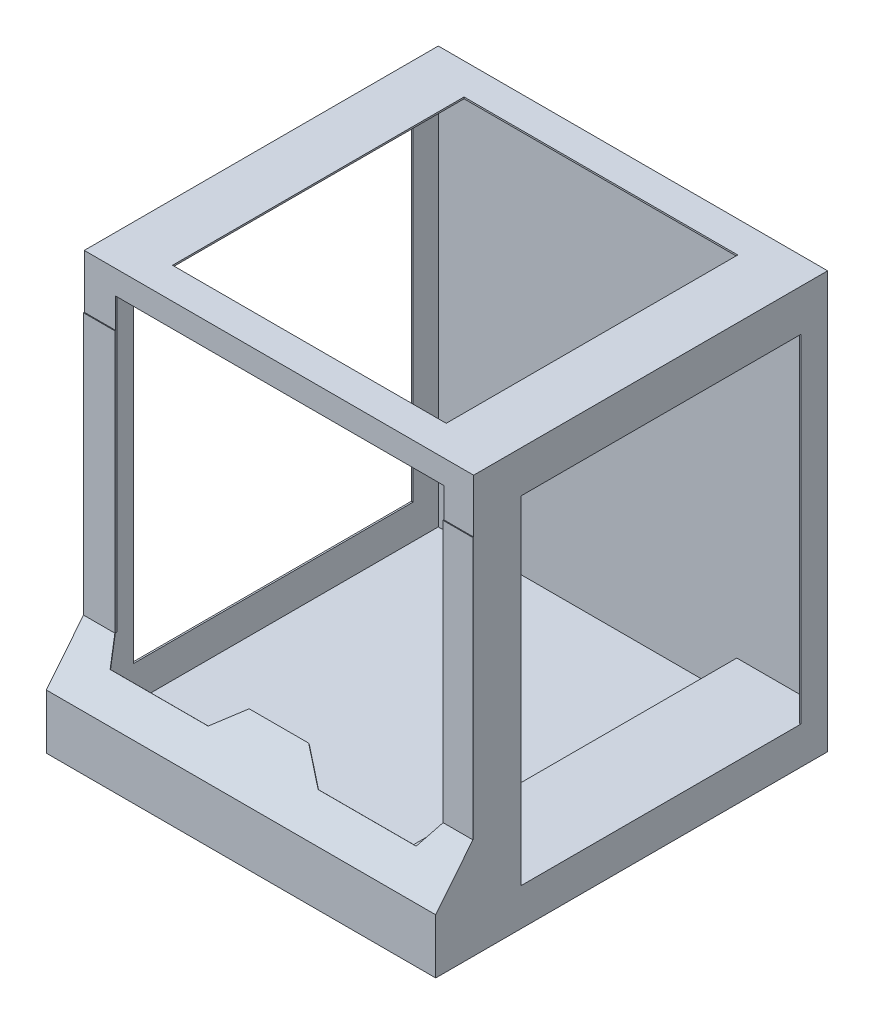
from build123d import *

# Parameters (mm, degrees)
BOSS_EXTRUDE2_DEPTH  = 2.7
BOSS_EXTRUDE3_DEPTH  = 2.7
SKETCH5_W            = 654.4
SKETCH5_H            = 657.577951389
BOSS_EXTRUDE4_DEPTH  = 2.7
SKETCH6_W            = 654.4
SKETCH6_H            = 595
BOSS_EXTRUDE5_DEPTH  = 2.7
SKETCH10_W           = 649
SKETCH10_H           = 700
BOSS_EXTRUDE6_DEPTH  = 2.7
SKETCH11_W           = 470
SKETCH11_H           = 570
CUT_EXTRUDE2_DEPTH   = 1163.186353387
CUT_EXTRUDE3_REACH   = 1164.186
SKETCH12_W           = 460
SKETCH12_H           = 490
BOSS_EXTRUDE8_DEPTH  = 2.7
BOSS_EXTRUDE10_DEPTH = 654.4
SKETCH15_W           = 1.4
SKETCH15_H           = 440
BOSS_EXTRUDE12_DEPTH = 52.7
LPATTERN1_COUNT      = 2
LPATTERN1_PITCH      = 604.4
SKETCH16_W           = 354.359713547
SKETCH16_H           = 772.074648607
CUT_EXTRUDE5_DEPTH   = 55
CUT_EXTRUDE6_DEPTH   = 25
SKETCH19_W           = 150
SKETCH19_H           = 655
BOSS_EXTRUDE13_DEPTH = 60


with BuildPart() as part:
    # Sketch2 → Boss-Extrude2 (new body)
    with BuildSketch(Plane(origin=(0, 0, 0), x_dir=(0, 0, -1), z_dir=(1, 0, 0))):
        Polygon((657.577951389, 700), (62.577951389, 700), (62.577951389, 170), (0, 92), (0, 0), (657.577951389, 0), align=None)
    extrude(amount=BOSS_EXTRUDE2_DEPTH)



with BuildPart() as body_2:
    # Sketch4 → Boss-Extrude3 (new body)
    with BuildSketch(Plane(origin=(651.7, 0, 0), x_dir=(0, 0, -1), z_dir=(1, 0, 0))):
        Polygon((657.577951389, 700), (62.577951389, 700), (62.577951389, 170), (0, 92), (0, 0), (657.577951389, 0), align=None)
    extrude(amount=BOSS_EXTRUDE3_DEPTH)


with BuildPart() as part_1:
    add(part.part)

    add(body_2.part)  # Boss-Extrude4 merges body 2
    # Sketch5 → Boss-Extrude4 (add)
    with BuildSketch(Plane(origin=(0, 0, 0), x_dir=(1, 0, 0), z_dir=(0, 1, 0))):
        with Locations((327.2, 328.788975695)):
            Rectangle(SKETCH5_W, SKETCH5_H)
    extrude(amount=BOSS_EXTRUDE4_DEPTH)

    # Sketch6 → Boss-Extrude5 (add)
    with BuildSketch(Plane(origin=(0, 700, 0), x_dir=(-1, 0, 0), z_dir=(0, -1, 0))):
        with Locations((-327.2, 360.077951389)):
            Rectangle(SKETCH6_W, SKETCH6_H)
    extrude(amount=BOSS_EXTRUDE5_DEPTH)

    # Sketch10 → Boss-Extrude6 (add)
    with BuildSketch(Plane.XY.offset(-657.6)):
        with Locations((327.2, 350)):
            Rectangle(SKETCH10_W, SKETCH10_H)
    extrude(amount=BOSS_EXTRUDE6_DEPTH)

    # Sketch11 → Cut-Extrude2 (cut, through all)
    with BuildSketch(Plane.ZY):
        with Locations((-377.577951389, 345)):
            Rectangle(SKETCH11_W, SKETCH11_H)
    extrude(amount=-CUT_EXTRUDE2_DEPTH, mode=Mode.SUBTRACT)

    # Sketch12 → Cut-Extrude3 (cut, up to next)
    with BuildSketch(Plane(origin=(0, 700, 0), x_dir=(1, 0, 0), z_dir=(0, 1, 0)), mode=Mode.PRIVATE) as cut_extrude3_sk1:
        with Locations((325.85, 360.077951389)):
            Rectangle(SKETCH12_W, SKETCH12_H)
    cut_extrude3_tool1 = extrude(cut_extrude3_sk1.sketch, amount=-CUT_EXTRUDE3_REACH, mode=Mode.PRIVATE) & part_1.part
    add(cut_extrude3_tool1.solids().sort_by_distance((325.85, 700, -360.077951))[0], mode=Mode.SUBTRACT)

    # Sketch13 → Boss-Extrude8 (add)
    with BuildSketch(Plane.XY.offset(-62.577951389)):
        Polygon((2.7, 700), (2.7, 170), (52.7, 170), (52.7, 660), (604.4, 660), (604.4, 170), (654.4, 170), (654.4, 700), align=None)
    extrude(amount=-BOSS_EXTRUDE8_DEPTH)



with BuildPart() as body_2_2:
    # Sketch14 → Boss-Extrude10 (new body)
    with BuildSketch(Plane.ZY):
        Polygon((-62.577951389, 170), (-62.577951389, 171.4), (1.123193999, 92), (1.123193999, 0), (0, 0), (0, 92), align=None)
    extrude(amount=-BOSS_EXTRUDE10_DEPTH)

    # Sketch17 → Cut-Extrude6 (cut)
    with BuildSketch(Plane(origin=(0, 36.57544, 45.589289146), x_dir=(1, 0, 0), z_dir=(0, 0.6257795138864832, 0.779999999999998))):
        Polygon((52.7, 170.883908681), (70, 130.425593129), (234.773593129, 130.425593129), (277.2, 172.852), (377.2, 172.852), (419.626406871, 130.425593129), (584.4, 130.425593129), (604.4, 170.883908681), (604.4, 298.93024871), (52.7, 298.93024871), align=None)
    extrude(amount=-CUT_EXTRUDE6_DEPTH, mode=Mode.SUBTRACT)


with BuildPart() as body_3:
    # Sketch15 → Boss-Extrude12 (new body)
    with BuildSketch(Plane.ZY):
        with Locations((-61.877951389, 390)):
            Rectangle(SKETCH15_W, SKETCH15_H)
    boss_extrude12 = extrude(amount=-BOSS_EXTRUDE12_DEPTH)


with BuildPart() as lpattern1_1:
    # LPattern1: Boss-Extrude12 ×2
    with Locations(*[(i * LPATTERN1_PITCH, 0, 0) for i in range(1, LPATTERN1_COUNT)]):
        add(boss_extrude12)

    # Sketch16 → Cut-Extrude5 (cut)
    with BuildSketch(Plane(origin=(654.4, 0, 0), x_dir=(0, 0, -1), z_dir=(1, 0, 0))):
        with Locations((117.246964879, 341.40946149)):
            Rectangle(SKETCH16_W, SKETCH16_H)
    extrude(amount=CUT_EXTRUDE5_DEPTH, mode=Mode.SUBTRACT)


with BuildPart() as part_2:
    add(part_1.part)

    add(body_2_2.part)  # Boss-Extrude13 merges body 2 2
    # Sketch19 → Boss-Extrude13 (add)
    with BuildSketch(Plane(origin=(0, 2.7, 0), x_dir=(1, 0, 0), z_dir=(0, 1, 0))):
        with Locations((579.4, 330.1)):
            Rectangle(SKETCH19_W, SKETCH19_H)
    extrude(amount=BOSS_EXTRUDE13_DEPTH)


solid = Compound([body_3.part, lpattern1_1.part, part_2.part])
